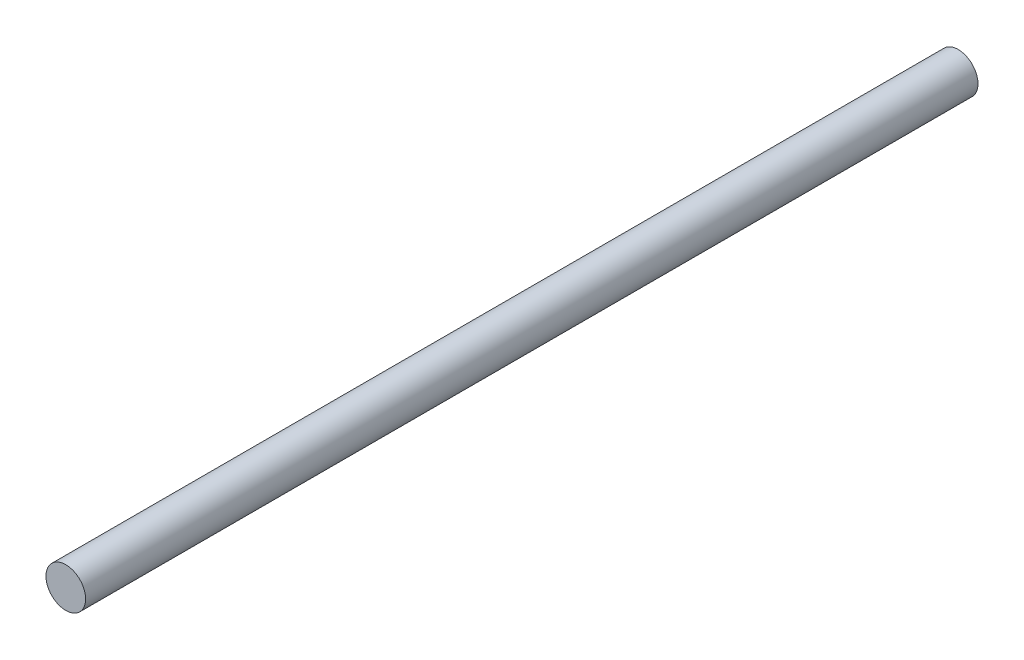
from build123d import *

# Parameters (mm, degrees)
SKETCH1_R           = 30
BOSS_EXTRUDE1_DEPTH = 1350


with BuildPart() as part:
    # Sketch1 → Boss-Extrude1 (new body)
    with BuildSketch(Plane.XY):
        Circle(SKETCH1_R)
    extrude(amount=BOSS_EXTRUDE1_DEPTH)


solid = part.part
